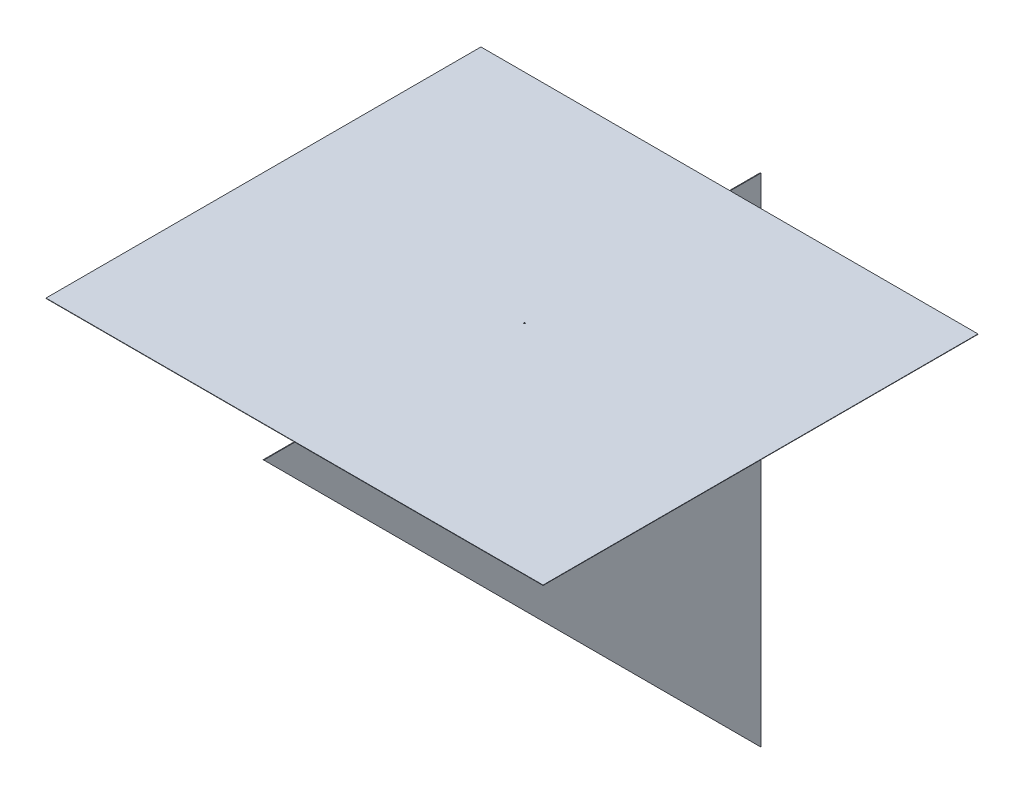
from build123d import *

# Parameters (mm, degrees)
EXTRUDE_1_DEPTH = 5
SKETCH_2_W      = 4000
SKETCH_2_H      = 3500
SKETCH_2_R      = 0.5
SKETCH_2_R_2    = 5
EXTRUDE_2_DEPTH = 3


with BuildPart() as part:
    # Эскиз1 → Бобышка-Вытянуть1 (new body)
    with BuildSketch(Plane(origin=(0, 0, 0), x_dir=(0, 0, -1), z_dir=(1, 0, 0))):
        Polygon((-4000, 4000), (0, 0), (0, 4000), align=None)
    extrude(amount=EXTRUDE_1_DEPTH)

    # Эскиз2 → Бобышка-Вытянуть2 (add)
    with BuildSketch(Plane(origin=(0, 4000, 0), x_dir=(1, 0, 0), z_dir=(0, 1, 0))):
        with Locations((2.5, -2000)):
            Rectangle(SKETCH_2_W, SKETCH_2_H)
        with Locations(Location((-97.5, -2000, 0), (0, 0, 270))):
            Circle(SKETCH_2_R, mode=Mode.SUBTRACT)
        with Locations(Location((102.5, -2000, 0), (0, 0, 270))):
            Circle(SKETCH_2_R_2, mode=Mode.SUBTRACT)
    extrude(amount=EXTRUDE_2_DEPTH)


solid = part.part
